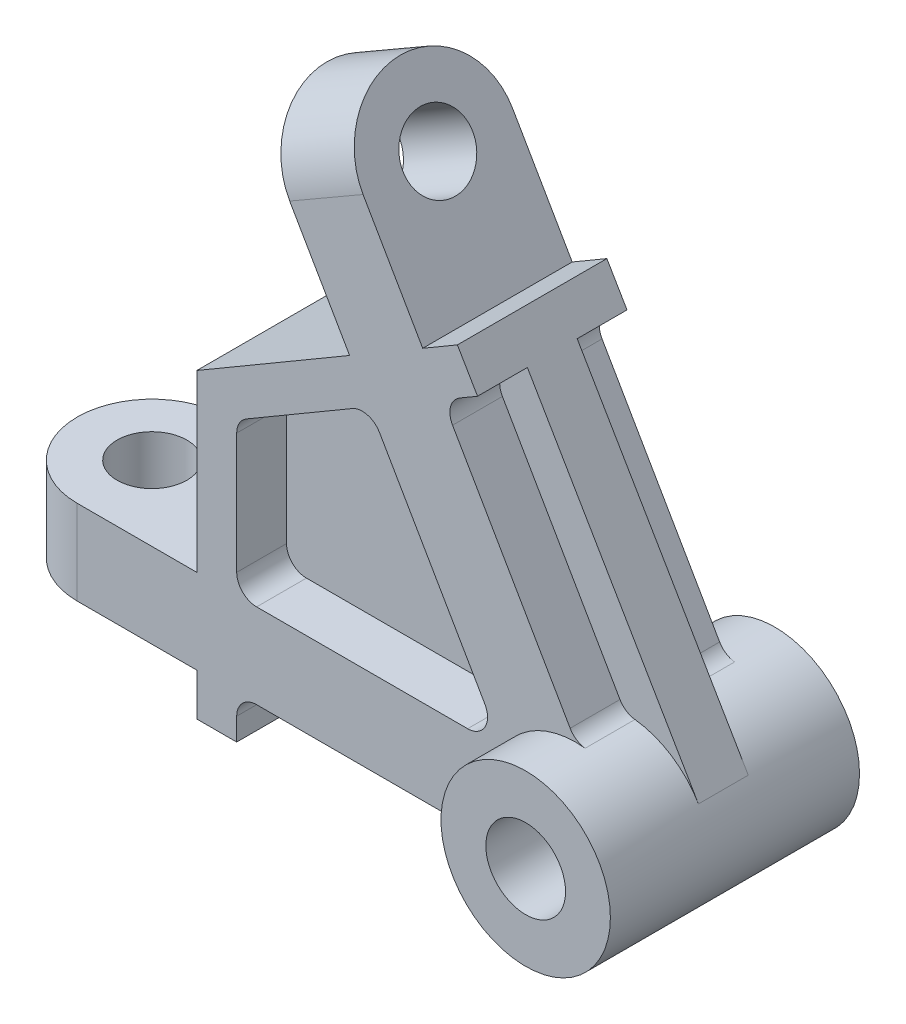
from build123d import *

# Parameters (mm, degrees)
SKETCH1_R           = 42.5
SKETCH1_R_2         = 20
BOSS_EXTRUDE1_DEPTH = 62.5
SKETCH2_R           = 17.5
BOSS_EXTRUDE2_DEPTH = 21.25
CIRPATTERN1_COUNT   = 2
CIRPATTERN1_ANGLE   = 300
SKETCH3_R           = 20
BOSS_EXTRUDE3_DEPTH = 12.5
BOSS_EXTRUDE4_DEPTH = 37.5
FILLET1_R           = 10


with BuildPart() as part:
    # Sketch1 → Boss-Extrude1 (new, symmetric)
    with BuildSketch(Plane.XY):
        Circle(SKETCH1_R)
        Circle(SKETCH1_R_2, mode=Mode.SUBTRACT)
    extrude(amount=BOSS_EXTRUDE1_DEPTH, both=True)

    # Sketch2 → Boss-Extrude2 (add, symmetric)
    with BuildSketch(Plane(origin=(0, 0, 0), x_dir=(1, 0, 0), z_dir=(0, 1, 0))):
        with BuildLine():
            Line((-20, -37.5), (-20, 37.5))
            Line((-20, 37.5), (-250, 37.5))
            ThreePointArc((-250, 37.5), (-287.5, 0), (-250, -37.5))
            Line((-250, -37.5), (-20, -37.5))
        make_face()
        with Locations(Location((-250, 0, 0), (0, 0, 270))):
            Circle(SKETCH2_R, mode=Mode.SUBTRACT)
    boss_extrude2 = extrude(amount=BOSS_EXTRUDE2_DEPTH, both=True)

    # CirPattern1: Boss-Extrude2 ×2 about axis
    cirpattern1_axis = Axis((0, 0, 62.5), (0, 0, 1))
    for i in range(1, CIRPATTERN1_COUNT):
        add(boss_extrude2.rotate(cirpattern1_axis, i * CIRPATTERN1_ANGLE / (CIRPATTERN1_COUNT - 1)))

    # Sketch3 → Boss-Extrude3 (add, symmetric)
    with BuildSketch(Plane.XY):
        with BuildLine():
            Line((0, -42.5), (-170, -42.5))
            Line((-170, -42.5), (-170, 97.5))
            Line((-170, 97.5), (-49.160292921, 168.194873881))
            Line((-49.160292921, 168.194873881), (36.683482506, 21.460943857))
            ThreePointArc((36.683482506, 21.460943857), (36.866923617, -21.144265015), (0, -42.5))
        make_face()
        Circle(SKETCH3_R, mode=Mode.SUBTRACT)
    extrude(amount=BOSS_EXTRUDE3_DEPTH, both=True)

    # Sketch4 → Boss-Extrude4 (add, symmetric)
    with BuildSketch(Plane.XY):
        Polygon((-49.160292921, 168.194873881), (-170, 97.5), (-170, -42.5), (-190, -42.5), (-190, 108.970588235), (-59.259560618, 185.457689178), align=None)
    extrude(amount=BOSS_EXTRUDE4_DEPTH, both=True)

    # Fillet1
    fillet1_edges = [part.edges().sort_by_distance(p)[0] for p in [
        (-36.806079661, -21.25, -25),
        (-36.806079661, 21.25, -25),
        (-66.659357171, 157.95739342, -25),
        (-66.659357171, 157.95739342, 25),
        (-103.343444163, 136.49609592, -25),
        (-170, 97.5, -25),
        (-103.343444163, 136.49609592, 25),
        (-170, 97.5, 25),
        (-170, 21.25, -25),
        (-170, 21.25, 25),
        (-170, -21.25, -25),
        (-170, -21.25, 25),
        (0, 42.5, -25),
        (-36.806079661, 21.25, 25),
        (0, 42.5, 25),
        (-36.806079661, -21.25, 25),
    ]]
    fillet(fillet1_edges, radius=FILLET1_R)


solid = part.part
